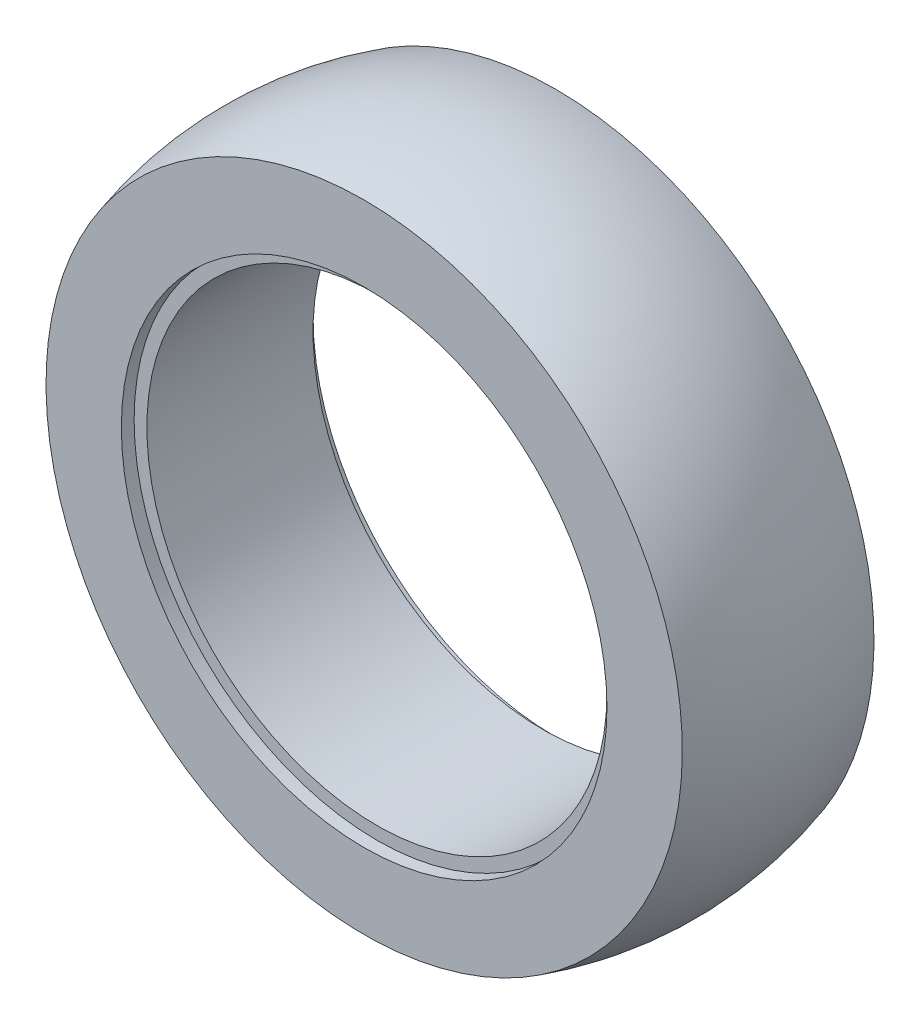
from build123d import *


with BuildPart() as part:
    # Esquisse1 → Révolution1 (revolve)
    with BuildSketch(Plane(origin=(0, 0, 0), x_dir=(0, 0, -1), z_dir=(1, 0, 0)), mode=Mode.PRIVATE) as r_volution1_sk:
        with BuildLine():
            Line((-6.5, 18), (6.5, 18))
            Line((6.5, 18), (6.5, 19))
            Line((6.5, 19), (7.5, 19))
            Line((7.5, 19), (7.5, 24.894778569))
            ThreePointArc((7.5, 24.894778569), (0, 26), (-7.5, 24.894778569))
            Line((-7.5, 24.894778569), (-7.5, 19))
            Line((-7.5, 19), (-6.5, 19))
            Line((-6.5, 19), (-6.5, 18))
        make_face()
    revolve(r_volution1_sk.sketch.rotate(Axis((0, 0, 2.4656375), (0, 0, -1)), 90), axis=Axis((0, 0, 2.4656375), (0, 0, -1)))


solid = part.part
